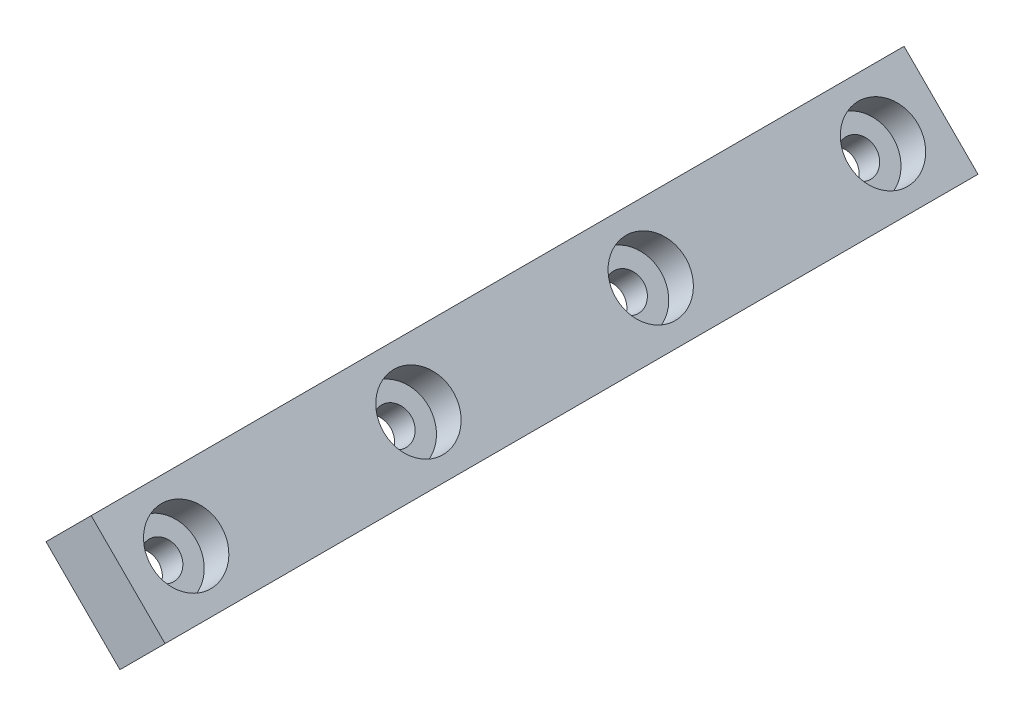
from build123d import *

# Parameters (mm, degrees)
EXTRUDE_2_DEPTH     = 75
SKETCH_5_R          = 1.5
CUT_EXTRUDE_1_DEPTH = 75
SKETCH_7_R          = 3
CUT_EXTRUDE_2_DEPTH = 3
CUT_EXTRUDE_3_DEPTH = 5


with BuildPart() as part:
    # Model → 凸台-拉伸2 (new body)
    with BuildSketch(Plane.XY):
        Polygon((81.281714853, 50.079307879), (85.170802149, 53.968395176), (91.53476318, 47.604434145), (87.645675883, 43.715346849), align=None)
    extrude(amount=EXTRUDE_2_DEPTH)

    # 草图5 → 切除-拉伸1 (cut)
    with BuildSketch(Plane(origin=(69.569598662, 69.569598663, 0), x_dir=(0, 0, -1), z_dir=(0.7071067811850318, 0.7071067811880632, 0))):
        with Locations(Location((-65, -26.56343356, 0), (0, 0, 90))):
            Circle(SKETCH_5_R)
        with Locations(Location((-45, -26.56343356, 0), (0, 0, 90))):
            Circle(SKETCH_5_R)
        with Locations(Location((-25, -26.56343356, 0), (0, 0, 90))):
            Circle(SKETCH_5_R)
        with Locations(Location((-5, -26.56343356, 0), (0, 0, 90))):
            Circle(SKETCH_5_R)
    extrude(amount=-CUT_EXTRUDE_1_DEPTH, mode=Mode.SUBTRACT)

    # 草图7 → 切除-拉伸2 (cut)
    with BuildSketch(Plane(origin=(69.569598662, 69.569598663, 0), x_dir=(0, 0, -1), z_dir=(0.7071067811850318, 0.7071067811880632, 0))):
        with Locations(Location((-5, -26.56343356, 0), (0, 0, 90))):
            Circle(SKETCH_7_R)
        with Locations(Location((-25, -26.56343356, 0), (0, 0, 90))):
            Circle(SKETCH_7_R)
        with Locations(Location((-45, -26.56343356, 0), (0, 0, 90))):
            Circle(SKETCH_7_R)
        with Locations(Location((-65, -26.56343356, 0), (0, 0, 90))):
            Circle(SKETCH_7_R)
    extrude(amount=-CUT_EXTRUDE_2_DEPTH, mode=Mode.SUBTRACT)

    # 草图8 → 切除-拉伸3 (cut)
    with BuildSketch(Plane.XY.offset(75)):
        Polygon((87.645675883, 43.715346849), (91.53476318, 47.604434145), (85.134022188, 54.005175138), (81.244934891, 50.116087842), align=None)
    extrude(amount=-CUT_EXTRUDE_3_DEPTH, mode=Mode.SUBTRACT)


solid = part.part
